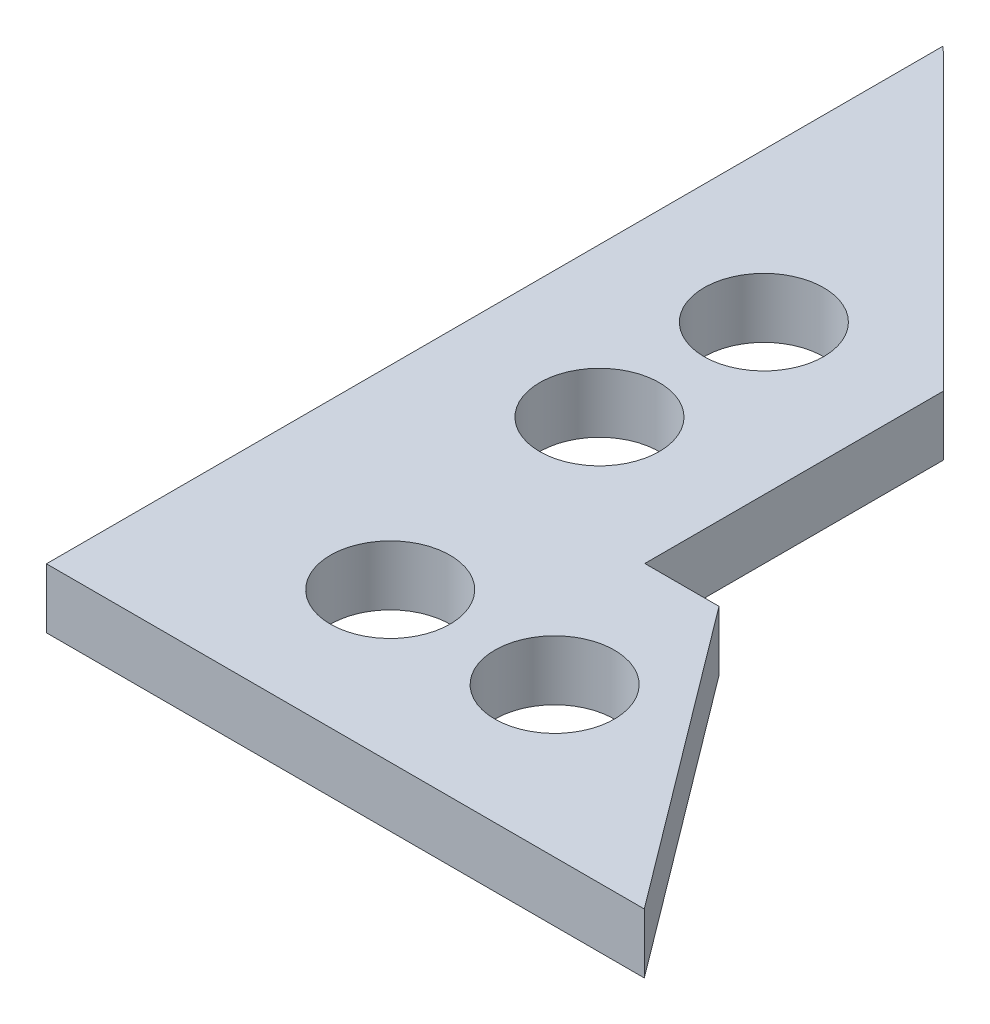
from build123d import *

# Parameters (mm, degrees)
BOSS_EXTRUDE1_DEPTH = 5.08
SKETCH2_R           = 5.08
CUT_EXTRUDE1_DEPTH  = 7.62


with BuildPart() as part:
    # Sketch1 → Boss-Extrude1 (new body)
    with BuildSketch(Plane(origin=(0, 0, 0), x_dir=(1, 0, 0), z_dir=(0, 1, 0))):
        Polygon((0, 0), (0, 76.2), (25.4, 50.827799649), (25.4, 25.442966498), (31.70483515, 25.442966498), (50.8, 0), align=None)
    extrude(amount=BOSS_EXTRUDE1_DEPTH)

    # Sketch2 → Cut-Extrude1 (cut)
    with BuildSketch(Plane(origin=(0, 5.08, 0), x_dir=(1, 0, 0), z_dir=(0, 1, 0))):
        with Locations(Location((12.7, 34.29, 0), (0, 0, 270))):
            Circle(SKETCH2_R)
        with Locations(Location((12.7, 48.26, 0), (0, 0, 270))):
            Circle(SKETCH2_R)
        with Locations(Location((16.51, 12.7, 0), (0, 0, 270))):
            Circle(SKETCH2_R)
        with Locations(Location((30.48, 12.7, 0), (0, 0, 270))):
            Circle(SKETCH2_R)
    extrude(amount=-CUT_EXTRUDE1_DEPTH, mode=Mode.SUBTRACT)


solid = part.part
